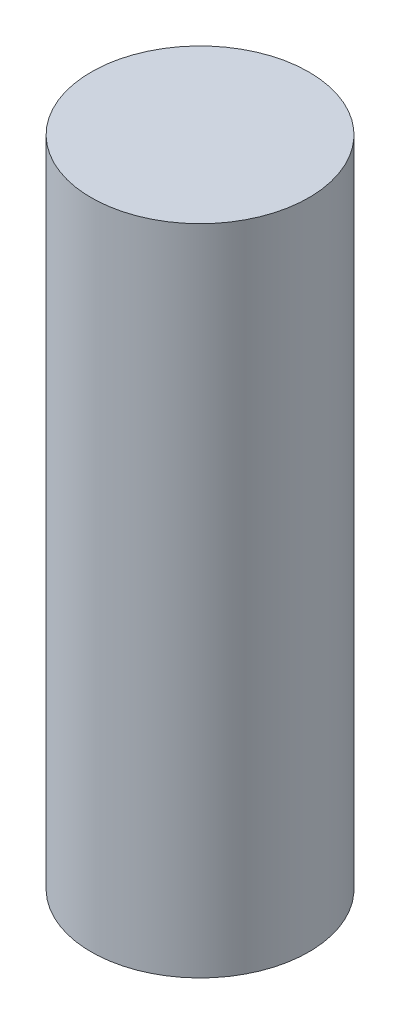
from build123d import *

# Parameters (mm, degrees)
SKETCH1_R           = 6.35
BOSS_EXTRUDE1_DEPTH = 38.1


with BuildPart() as part:
    # Sketch1 → Boss-Extrude1 (new body)
    with BuildSketch(Plane(origin=(0, 0, 0), x_dir=(1, 0, 0), z_dir=(0, 1, 0))):
        with Locations(Location((0, 0, 0), (0, 0, 90))):
            Circle(SKETCH1_R)
    extrude(amount=BOSS_EXTRUDE1_DEPTH)


solid = part.part
